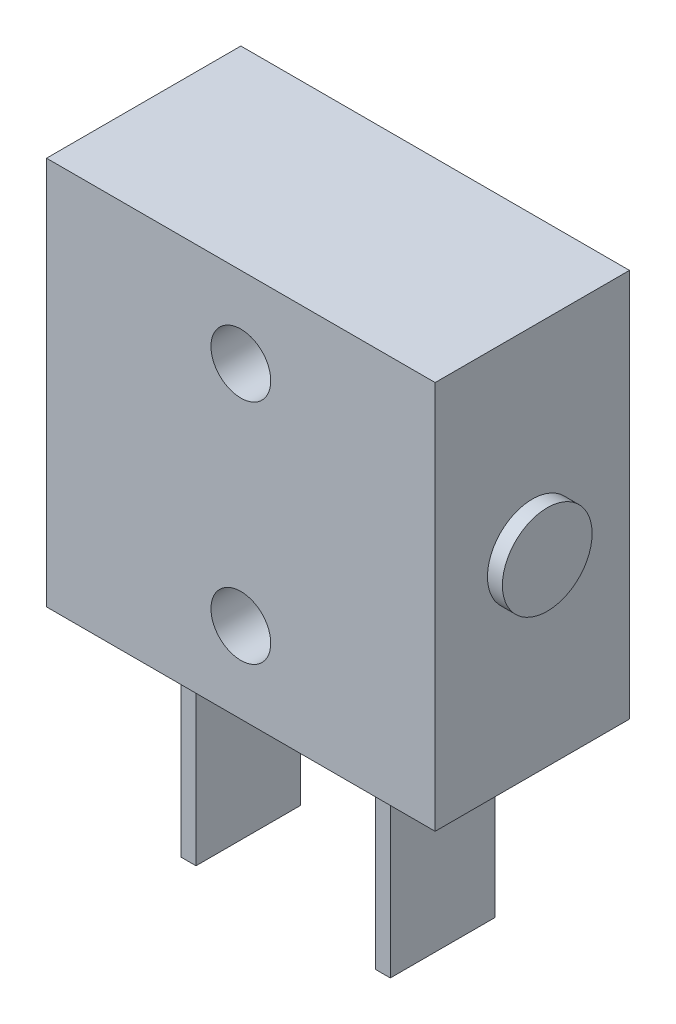
from build123d import *

# Parameters (mm, degrees)
SKETCH1_W           = 13
SKETCH1_H           = 13
BOSS_EXTRUDE1_DEPTH = 6.5
SKETCH2_W           = 0.5
SKETCH2_H           = 3.5
BOSS_EXTRUDE2_DEPTH = 6.5
SKETCH3_R           = 1
CUT_EXTRUDE1_DEPTH  = 16.921683328
SKETCH4_R           = 1.5
BOSS_EXTRUDE3_DEPTH = 0.5


with BuildPart() as part:
    # Sketch1 → Boss-Extrude1 (new body)
    with BuildSketch(Plane.XY):
        Rectangle(SKETCH1_W, SKETCH1_H)
    extrude(amount=BOSS_EXTRUDE1_DEPTH)

    # Sketch2 → Boss-Extrude2 (add)
    with BuildSketch(Plane.XZ.offset(6.5)):
        with Locations((-3.25, 3.25)):
            Rectangle(SKETCH2_W, SKETCH2_H)
        with Locations((3.25, 3.25)):
            Rectangle(SKETCH2_W, SKETCH2_H)
    extrude(amount=BOSS_EXTRUDE2_DEPTH)

    # Sketch3 → Cut-Extrude1 (cut, through all)
    with BuildSketch(Plane.XY.offset(6.5)):
        with Locations((0, 3.8)):
            Circle(SKETCH3_R)
        with Locations((0, -3.8)):
            Circle(SKETCH3_R)
    extrude(amount=-CUT_EXTRUDE1_DEPTH, mode=Mode.SUBTRACT)

    # Sketch4 → Boss-Extrude3 (add)
    with BuildSketch(Plane(origin=(6.5, 0, 0), x_dir=(0, 0, -1), z_dir=(1, 0, 0))):
        with Locations(Location((-3.25, 0, 0), (0, 0, 270))):
            Circle(SKETCH4_R)
    extrude(amount=BOSS_EXTRUDE3_DEPTH)


solid = part.part
